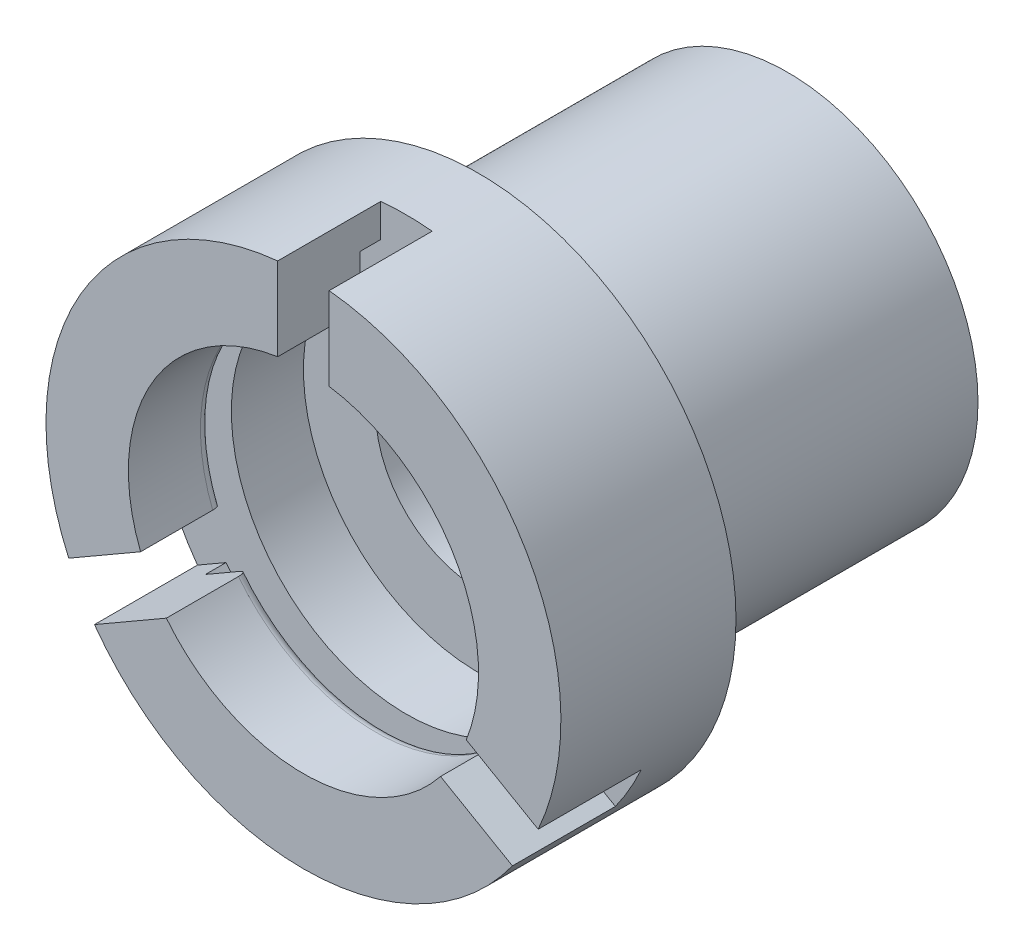
from build123d import *

# Parameters (mm, degrees)
SKETCH_1_R          = 1.85
SKETCH_1_R_2        = 1
EXTRUDE_3_DEPTH     = 3
SKETCH_4_R          = 2.5
SKETCH_4_R_2        = 1.7
EXTRUDE_4_DEPTH     = 1.7
CUT_EXTRUDE_3_DEPTH = 1
SKETCH_7_W          = 0.2
SKETCH_7_H          = 0.5
FILLET_1_R          = 0.1


with BuildPart() as part:
    # Эскиз1 → Бобышка-Вытянуть3 (new body)
    with BuildSketch(Plane.XY):
        Circle(SKETCH_1_R)
        Circle(SKETCH_1_R_2, mode=Mode.SUBTRACT)
    extrude(amount=EXTRUDE_3_DEPTH)

    # Эскиз4 → Бобышка-Вытянуть4 (add)
    with BuildSketch(Plane.XY.offset(3)):
        Circle(SKETCH_4_R)
        Circle(SKETCH_4_R_2, mode=Mode.SUBTRACT)
    extrude(amount=EXTRUDE_4_DEPTH)

    # Эскиз5 → Вырез-Вытянуть3 (cut)
    with BuildSketch(Plane.XY.offset(4.7)):
        with BuildLine():
            Line((0.25, 1.580348063), (0.25, 2.5))
            ThreePointArc((0.25, 2.5), (0, 2.512468905), (-0.25, 2.5))
            Line((-0.25, 2.5), (-0.25, 1.580348063))
            ThreePointArc((-0.25, 1.580348063), (0, 1.6), (0.25, 1.580348063))
        make_face()
        with BuildLine():
            Line((1.243621569, -1.006680382), (2.040063509, -1.466506351))
            ThreePointArc((2.040063509, -1.466506351), (2.175861898, -1.256234453), (2.290063509, -1.033493649))
            Line((2.290063509, -1.033493649), (1.493621569, -0.573667681))
            ThreePointArc((1.493621569, -0.573667681), (1.385640646, -0.8), (1.243621569, -1.006680382))
        make_face()
        with BuildLine():
            Line((-1.493621569, -0.573667681), (-2.290063509, -1.033493649))
            ThreePointArc((-2.290063509, -1.033493649), (-2.175861898, -1.256234453), (-2.040063509, -1.466506351))
            Line((-2.040063509, -1.466506351), (-1.243621569, -1.006680382))
            ThreePointArc((-1.243621569, -1.006680382), (-1.385640646, -0.8), (-1.493621569, -0.573667681))
        make_face()
    extrude(amount=-CUT_EXTRUDE_3_DEPTH, mode=Mode.SUBTRACT)

    # Эскиз7 → Вырез-Повернуть1 (revolve, cut)
    with BuildSketch(Plane(origin=(0, 0, 0), x_dir=(0, 0, -1), z_dir=(1, 0, 0)), mode=Mode.PRIVATE) as cut_revolve_1_sk:
        with Locations((-3.8, 1.931517172)):
            Rectangle(SKETCH_7_W, SKETCH_7_H)
    revolve(cut_revolve_1_sk.sketch.rotate(Axis((0, 0, 0), (0, 0, 1)), 270), axis=Axis((0, 0, 0), (0, 0, 1)), mode=Mode.SUBTRACT)

    # Скругление1
    fillet_1_edges = [part.edges().sort_by_distance(p)[0] for p in [
        (0, -1.7, 3.9),
        (1.472243186, 0.85, 3.9),
        (-1.472243186, 0.85, 3.9),
    ]]
    fillet(fillet_1_edges, radius=FILLET_1_R)


solid = part.part
